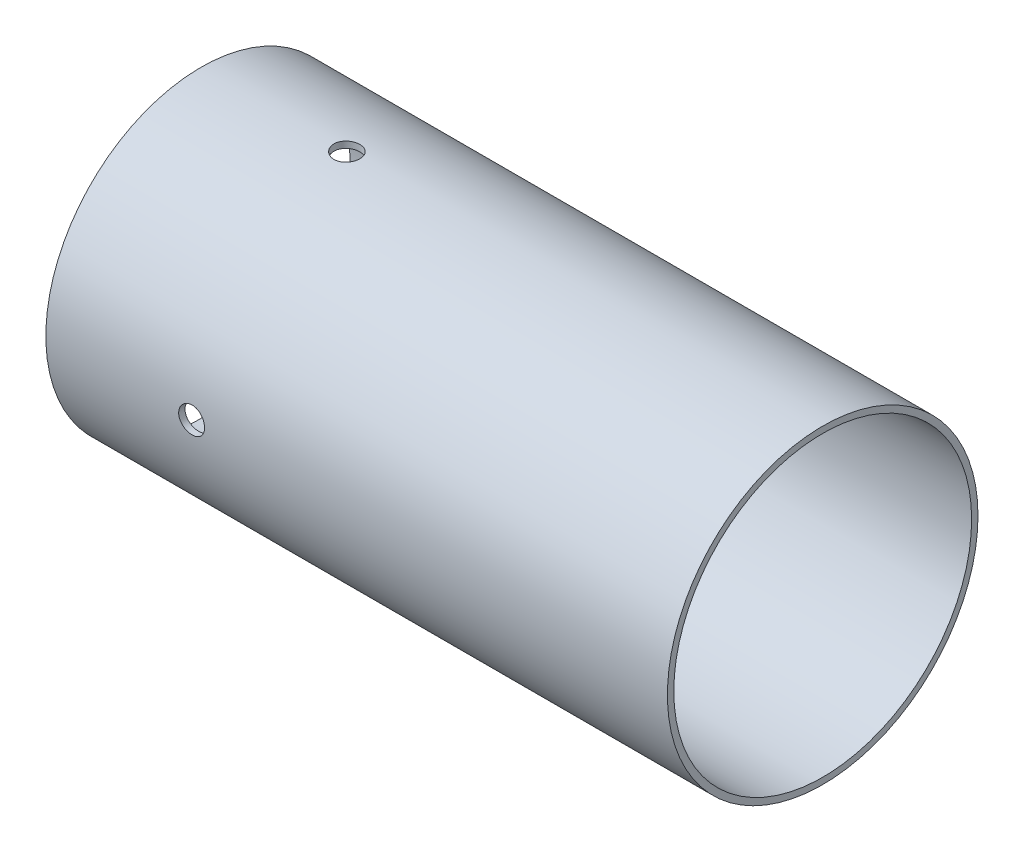
from build123d import *

# Parameters (mm, degrees)
SKETCH1_R           = 38.0746
SKETCH1_R_2         = 36.5125
BOSS_EXTRUDE1_DEPTH = 152.4
SKETCH2_R           = 3.175
CUT_EXTRUDE1_DEPTH  = 162.632640052
CIRPATTERN1_COUNT   = 4


with BuildPart() as part:
    # Sketch1 → Boss-Extrude1 (new body)
    with BuildSketch(Plane.YZ):
        with Locations(Location((0, 0, 0), (0, 0, 90))):
            Circle(SKETCH1_R)
        with Locations(Location((0, 0, 0), (0, 0, 90))):
            Circle(SKETCH1_R_2, mode=Mode.SUBTRACT)
    extrude(amount=BOSS_EXTRUDE1_DEPTH)

    # Sketch2 → Cut-Extrude1 (cut, through all)
    with BuildSketch(Plane(origin=(0, 0, 0), x_dir=(-1, 0, 0), z_dir=(0, 1, 0))):
        with Locations(Location((-35.7378, 0, 0), (0, 0, 270))):
            Circle(SKETCH2_R)
    cut_extrude1 = extrude(amount=CUT_EXTRUDE1_DEPTH, mode=Mode.SUBTRACT)

    # CirPattern1: Cut-Extrude1 ×4 about axis
    cirpattern1_axis = Axis((152.4, 0, 0), (-1, 0, 0))
    for i in range(1, CIRPATTERN1_COUNT):
        add(cut_extrude1.rotate(cirpattern1_axis, i * 360 / CIRPATTERN1_COUNT), mode=Mode.SUBTRACT)


solid = part.part
